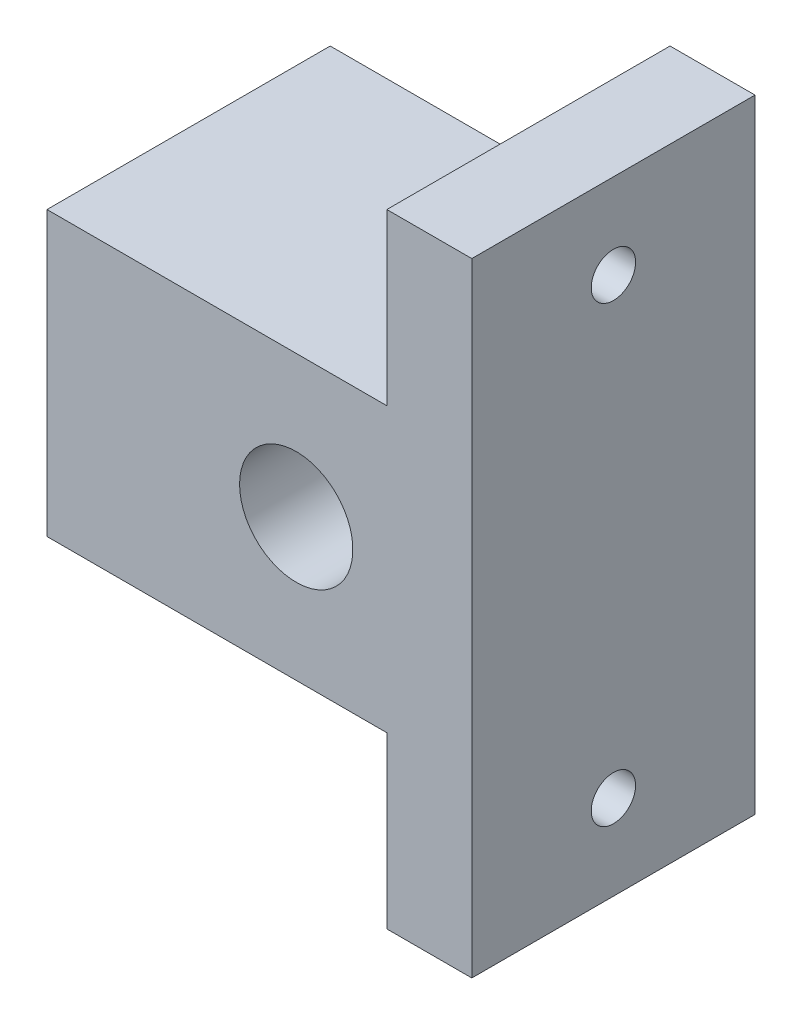
from build123d import *

# Parameters (mm, degrees)
SKETCH1_W                = 15
SKETCH1_H                = 22
BOSS_EXTRUDE1_DEPTH      = 10
SKETCH2_W                = 12
SKETCH2_H                = 6
CUT_EXTRUDE1_DEPTH       = 50.771980069
SKETCH3_W                = 12
SKETCH3_H                = 6
CUT_EXTRUDE2_DEPTH       = 50.771980069
F_4_0_4_DIAMETER_HOLE1_D = 4


with BuildPart() as part:
    # Sketch1 → Boss-Extrude1 (new body)
    with BuildSketch(Plane(origin=(0, 0, 15), x_dir=(-1, 0, 0), z_dir=(0, 0, -1))):
        with Locations((40, 0)):
            Rectangle(SKETCH1_W, SKETCH1_H)
    extrude(amount=-BOSS_EXTRUDE1_DEPTH)

    # Sketch2 → Cut-Extrude1 (cut, through all)
    with BuildSketch(Plane.XY.offset(25)):
        with Locations((-41.5, 8)):
            Rectangle(SKETCH2_W, SKETCH2_H)
    extrude(amount=-CUT_EXTRUDE1_DEPTH, mode=Mode.SUBTRACT)

    # Sketch3 → Cut-Extrude2 (cut, through all)
    with BuildSketch(Plane.XY.offset(25)):
        with Locations((-41.5, -8)):
            Rectangle(SKETCH3_W, SKETCH3_H)
    extrude(amount=-CUT_EXTRUDE2_DEPTH, mode=Mode.SUBTRACT)

    # Sketch4 → Cut-Revolve1 (revolve, cut)
    with BuildSketch(Plane.XY.offset(20), mode=Mode.PRIVATE) as cut_revolve1_sk:
        Polygon((-35.5, 8.7835), (-35.5, 8), (-32.5, 8), (-32.5, 8.7835), (-34.5, 8.7835), align=None)
    revolve(cut_revolve1_sk.sketch.rotate(Axis((-35.5, 8, 20), (1, 0, 0)), 270), axis=Axis((-35.5, 8, 20), (1, 0, 0)), mode=Mode.SUBTRACT)

    # Sketch5 → Cut-Revolve2 (revolve, cut)
    with BuildSketch(Plane.XY.offset(20), mode=Mode.PRIVATE) as cut_revolve2_sk:
        Polygon((-35.5, -7.2165), (-35.5, -8), (-32.5, -8), (-32.5, -7.2165), (-34.5, -7.2165), align=None)
    revolve(cut_revolve2_sk.sketch.rotate(Axis((-35.5, -8, 20), (1, 0, 0)), 270), axis=Axis((-35.5, -8, 20), (1, 0, 0)), mode=Mode.SUBTRACT)

    # Ø4.0 (4) Diameter Hole1 (through all)
    with Locations(Plane(origin=(0, 0, 15), x_dir=(-1, 0, 0), z_dir=(0, 0, -1))):
        with Locations((38.7, 0)):
            Hole(F_4_0_4_DIAMETER_HOLE1_D / 2)


solid = part.part
